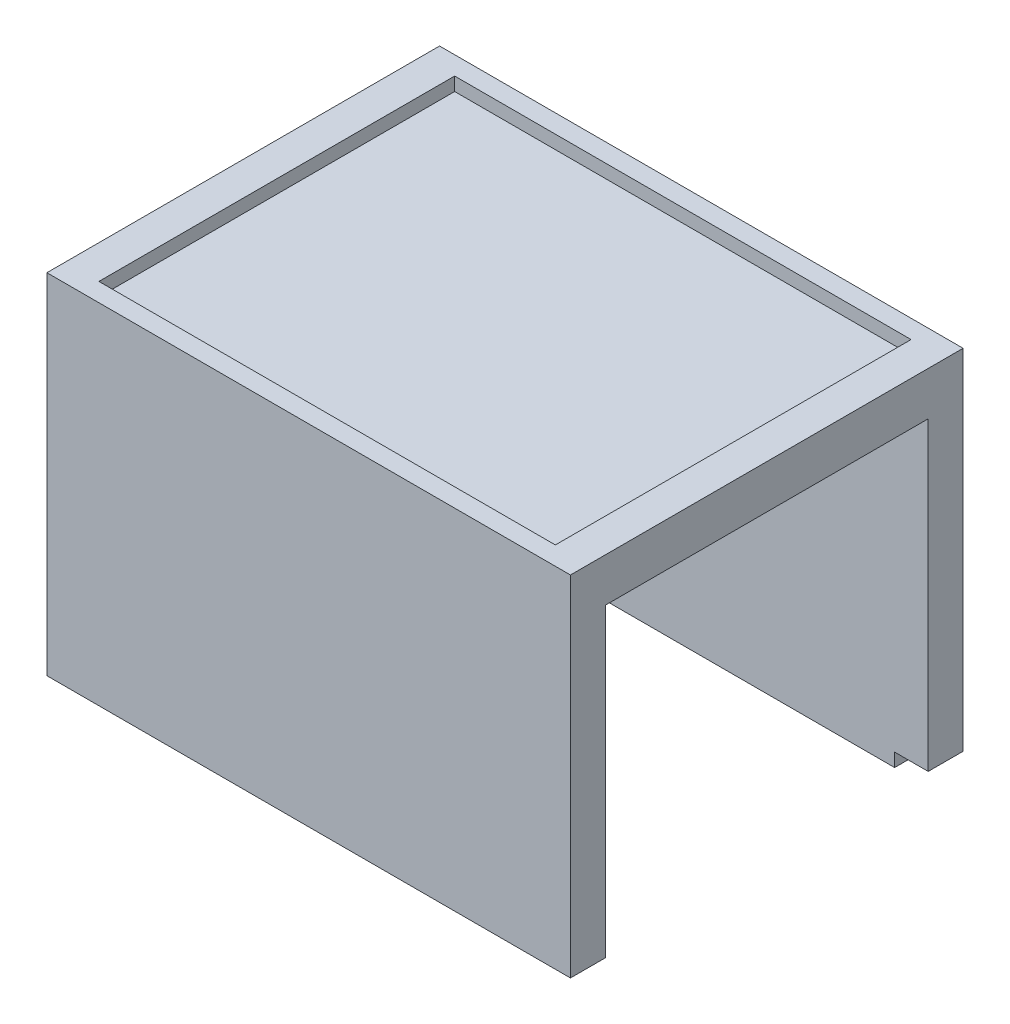
from build123d import *

# Parameters (mm, degrees)
SKETCH1_W           = 39
SKETCH1_H           = 29.25
BOSS_EXTRUDE1_DEPTH = 3.25
SKETCH2_W           = 34
SKETCH2_H           = 24
CUT_EXTRUDE1_DEPTH  = 1
SKETCH3_W           = 34
SKETCH3_H           = 1.25
CUT_EXTRUDE2_DEPTH  = 1
SKETCH4_W           = 39
SKETCH4_H           = 22.75
BOSS_EXTRUDE2_DEPTH = 2.6
SKETCH6_W           = 34
SKETCH6_H           = 1.25
BOSS_EXTRUDE3_DEPTH = 1


with BuildPart() as part:
    # Sketch1 → Boss-Extrude1 (new body)
    with BuildSketch(Plane(origin=(0, 0, 0), x_dir=(1, 0, 0), z_dir=(0, 1, 0))):
        Rectangle(SKETCH1_W, SKETCH1_H)
    extrude(amount=BOSS_EXTRUDE1_DEPTH)

    # Sketch2 → Cut-Extrude1 (cut)
    with BuildSketch(Plane(origin=(0, 3.25, 0), x_dir=(1, 0, 0), z_dir=(0, 1, 0))):
        Rectangle(SKETCH2_W, SKETCH2_H)
    extrude(amount=-CUT_EXTRUDE1_DEPTH, mode=Mode.SUBTRACT)

    # Sketch3 → Cut-Extrude2 (cut)
    with BuildSketch(Plane(origin=(0, 3.25, 0), x_dir=(1, 0, 0), z_dir=(0, 1, 0))):
        with Locations((0, -12.625)):
            Rectangle(SKETCH3_W, SKETCH3_H)
    cut_extrude2 = extrude(amount=-CUT_EXTRUDE2_DEPTH, mode=Mode.SUBTRACT)

    # Mirror1: Cut-Extrude2 across plane
    add(cut_extrude2.mirror(Plane.XY), mode=Mode.SUBTRACT)

    # Sketch4 → Boss-Extrude2 (add)
    with BuildSketch(Plane.XY.offset(14.625)):
        with Locations((0, -11.375)):
            Rectangle(SKETCH4_W, SKETCH4_H)
    boss_extrude2 = extrude(amount=-BOSS_EXTRUDE2_DEPTH)

    # Sketch6 → Boss-Extrude3 (add)
    with BuildSketch(Plane.XZ.offset(22.75)):
        with Locations((0, 12.65)):
            Rectangle(SKETCH6_W, SKETCH6_H)
    boss_extrude3 = extrude(amount=BOSS_EXTRUDE3_DEPTH)

    # Mirror2: Boss-Extrude2, Boss-Extrude3 across plane
    add(boss_extrude2.mirror(Plane.XY))
    add(boss_extrude3.mirror(Plane.XY))


solid = part.part
